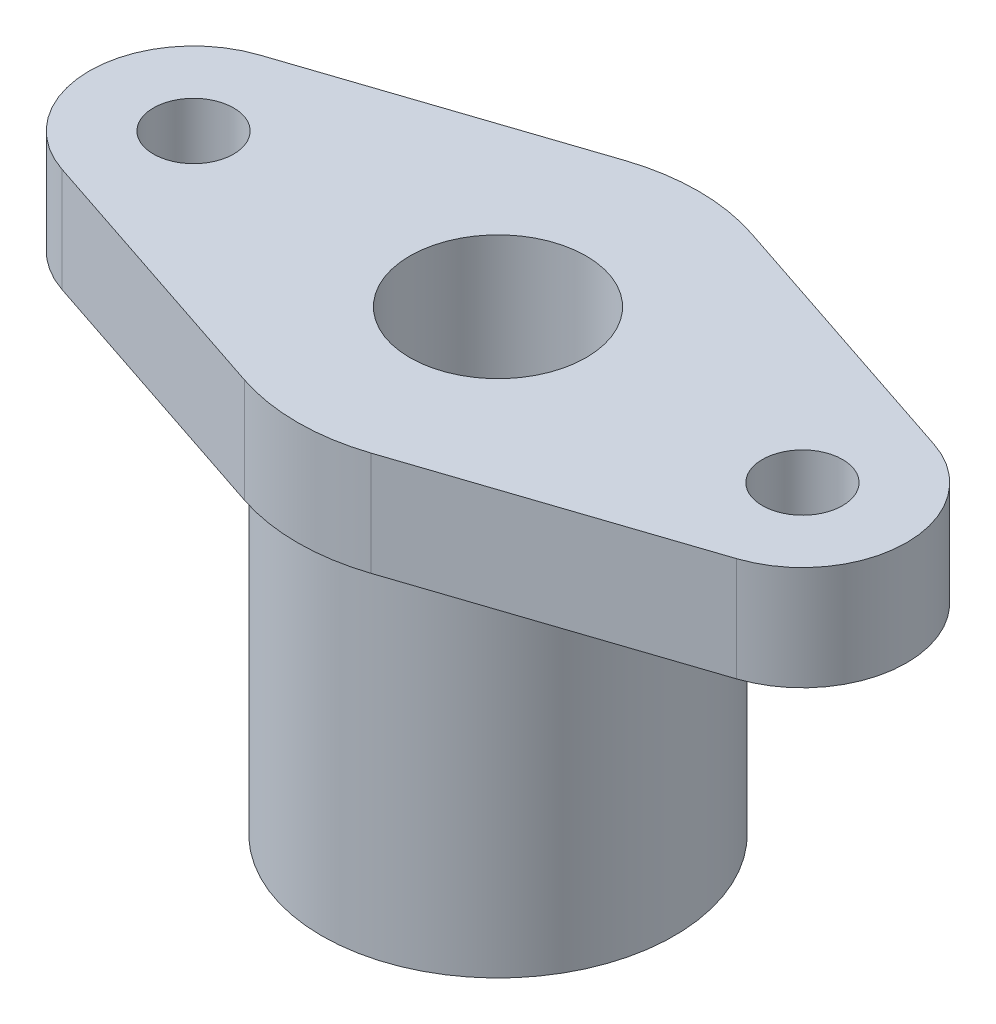
from build123d import *

# Parameters (mm, degrees)
SKETCH2_R           = 5
SKETCH2_R_2         = 11
BOSS_EXTRUDE2_DEPTH = 13


with BuildPart() as part:
    # Sketch1 → Revolve1 (revolve)
    with BuildSketch(Plane.XY):
        Polygon((-22, 0), (-22, 44), (-11, 44), (-11, 6.350852961), align=None)
    revolve(axis=Axis((0, 0, 0), (0, 1, 0)))

    # Sketch2 → Boss-Extrude2 (add)
    with BuildSketch(Plane(origin=(0, 44, 0), x_dir=(1, 0, 0), z_dir=(0, 1, 0))):
        with BuildLine():
            Line((7.905910187, -23.729102474), (42.109187711, -12.333473815))
            ThreePointArc((42.109187711, -12.333473815), (51, 0), (42.109187711, 12.333473815))
            Line((42.109187711, 12.333473815), (7.905910187, 23.729102474))
            ThreePointArc((7.905910187, 23.729102474), (0, 25.01147177), (-7.905910187, 23.729102474))
            Line((-7.905910187, 23.729102474), (-42.109187711, 12.333473815))
            ThreePointArc((-42.109187711, 12.333473815), (-51, 0), (-42.109187711, -12.333473815))
            Line((-42.109187711, -12.333473815), (-7.905910187, -23.729102474))
            ThreePointArc((-7.905910187, -23.729102474), (0, -25.01147177), (7.905910187, -23.729102474))
        make_face()
        with Locations((-38, 0)):
            Circle(SKETCH2_R, mode=Mode.SUBTRACT)
        with Locations((38, 0)):
            Circle(SKETCH2_R, mode=Mode.SUBTRACT)
        Circle(SKETCH2_R_2, mode=Mode.SUBTRACT)
    extrude(amount=BOSS_EXTRUDE2_DEPTH)


solid = part.part
